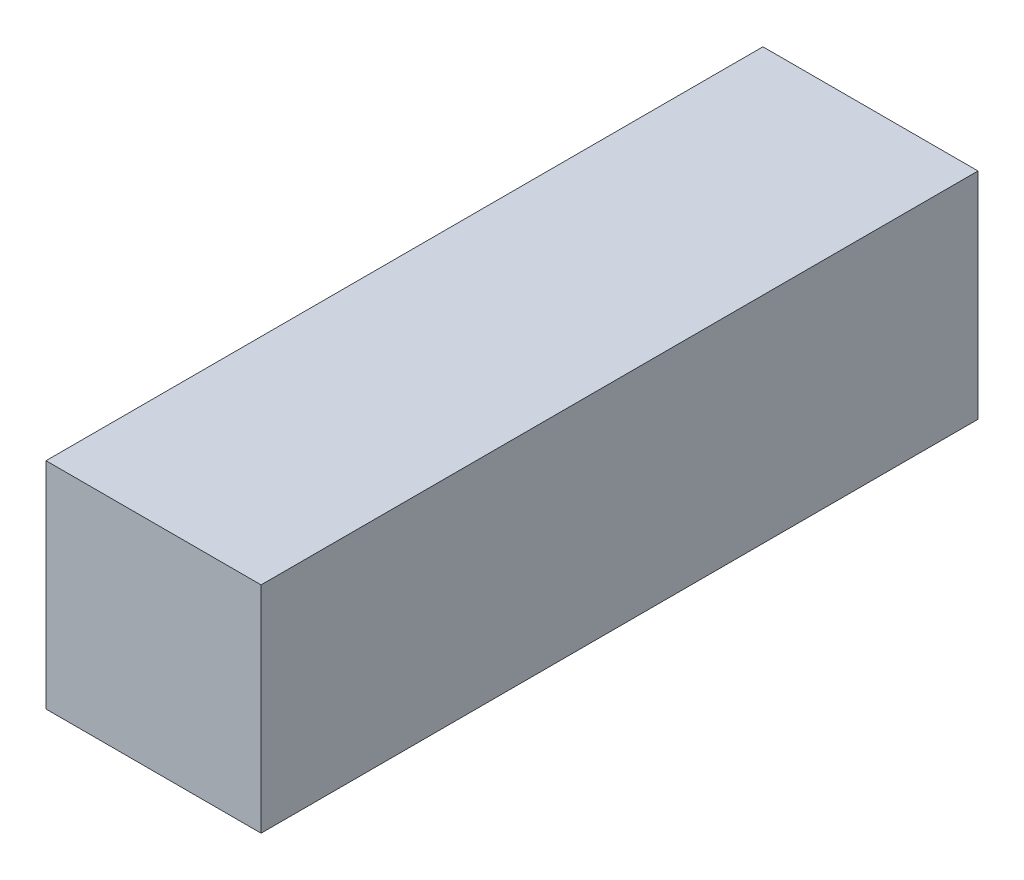
from build123d import *

# Parameters (mm, degrees)
BOSS_EXTRUDE1_DEPTH      = 5
BOSS_EXTRUDE1_DEPTH_BACK = 5
SKETCH3_W                = 3
SKETCH3_H                = 3


with BuildPart() as part:
    # Sketch3 → Boss-Extrude1 (new, two sides: drawn at the far end of the back side and taken through both)
    with BuildSketch(Plane.XY.offset(-BOSS_EXTRUDE1_DEPTH_BACK)):
        Rectangle(SKETCH3_W, SKETCH3_H)
    extrude(amount=BOSS_EXTRUDE1_DEPTH + BOSS_EXTRUDE1_DEPTH_BACK)


solid = part.part
